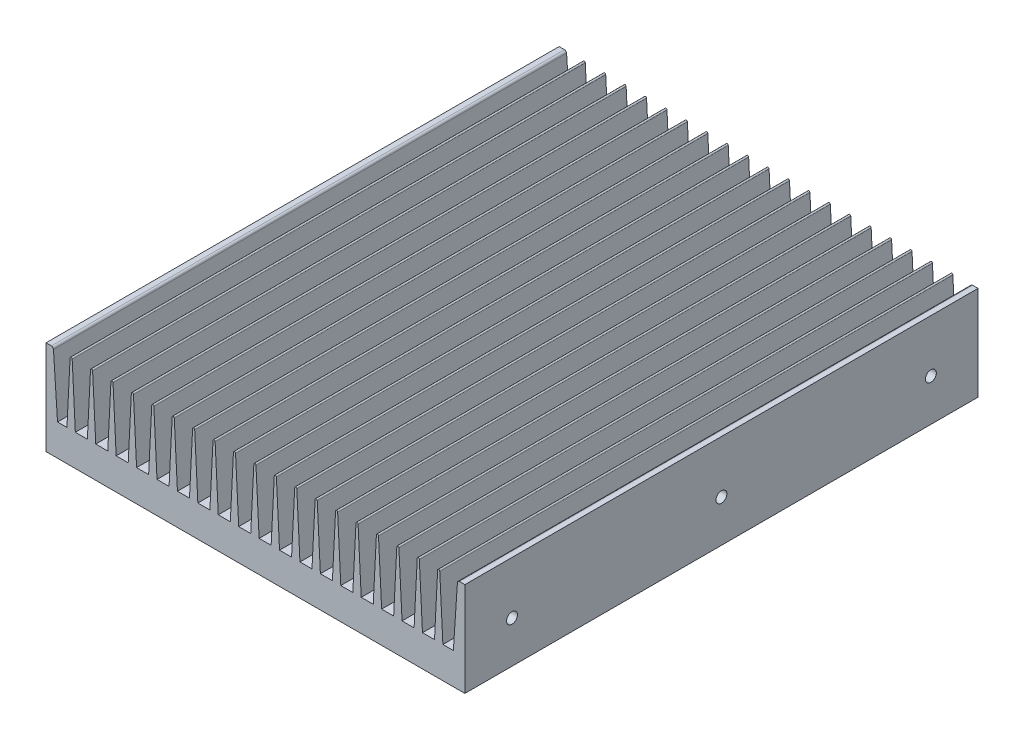
from build123d import *

# Parameters (mm, degrees)
EXTRUDE_1_DEPTH       = 245
EXTRUDE_3_DEPTH       = 245
PATTERN_CURVE_1_COUNT = 19
PATTERN_CURVE_1_PITCH = 9.75
SKETCH_7_R            = 2.6
CUT_EXTRUDE_4_DEPTH   = 6
SKETCH_8_R            = 4.5
SKETCH_8_R_2          = 3.4
CUT_EXTRUDE_5_DEPTH   = 6
CUT_EXTRUDE_START     = -6
SKETCH_9_R            = 2.6
CUT_EXTRUDE_6_DEPTH   = 6
EXTRUDE_4_REACH       = 321.453
SKETCH_11_R           = 2.6
EXTRUDE_5_REACH       = 321.453
SKETCH_12_R           = 4.5
SKETCH_12_R_2         = 3.4
SKETCH_19_R           = 2.6
CUT_EXTRUDE_12_DEPTH  = 8
SKETCH_21_R           = 2.6
SKETCH_21_R_2         = 1.6
SKETCH_21_R_3         = 1.3
SKETCH_21_R_4         = 2.1
CUT_EXTRUDE_13_DEPTH  = 10


with BuildPart() as part:
    # Эскиз1 → Вытянуть1 (new body)
    with BuildSketch(Plane.XY):
        with BuildLine():
            Line((0, 45), (2.564446908, 45))
            ThreePointArc((2.564446908, 45), (3.247630994, 44.730246195), (3.562232066, 44.066519011))
            Line((3.562232066, 44.066519011), (5.5, 15))
            Line((5.5, 15), (194.5, 15))
            Line((194.5, 15), (196.437767934, 44.066519011))
            ThreePointArc((196.437767934, 44.066519011), (196.752369006, 44.730246195), (197.435553092, 45))
            Line((197.435553092, 45), (200, 45))
            Line((200, 45), (200, 0))
            Line((200, 0), (0, 0))
            Line((0, 0), (0, 45))
        make_face()
    extrude(amount=EXTRUDE_1_DEPTH)

    # Эскиз2 → Вытянуть3 (add)
    with BuildSketch(Plane.XY.offset(245)):
        with BuildLine():
            Line((11.5, 44.5), (10, 15))
            Line((10, 15), (14, 15))
            Line((14, 15), (12.5, 44.5))
            ThreePointArc((12.5, 44.5), (12, 45), (11.5, 44.5))
        make_face()
    extrude_3 = extrude(amount=-EXTRUDE_3_DEPTH)

    # Кривая1: Вытянуть3 ×19
    with Locations(*[(i * PATTERN_CURVE_1_PITCH, 0, 0) for i in range(1, PATTERN_CURVE_1_COUNT)]):
        add(extrude_3)

    # Эскиз7 → Вырез-Вытянуть4 (cut)
    with BuildSketch(Plane.ZY):
        with Locations(Location((22.5, 20, 0), (0, 0, 270))):
            Circle(SKETCH_7_R)
        with Locations(Location((222.5, 20, 0), (0, 0, 270))):
            Circle(SKETCH_7_R)
        with Locations(Location((122.5, 20, 0), (0, 0, 270))):
            Circle(SKETCH_7_R)
    extrude(amount=-CUT_EXTRUDE_4_DEPTH, mode=Mode.SUBTRACT)

    # Эскиз8 → Вырез-Вытянуть5 (cut)
    with BuildSketch(Plane(origin=(200, 0, 0), x_dir=(0, 0, -1), z_dir=(1, 0, 0))):
        with Locations((-80, 30)):
            Circle(SKETCH_8_R)
        with Locations((-165, 30)):
            Circle(SKETCH_8_R_2)
    extrude(amount=-CUT_EXTRUDE_5_DEPTH, mode=Mode.SUBTRACT)

    # Эскиз9 → Вырез-Вытянуть6 (cut)
    with BuildSketch(Plane(origin=(200, 0, 0), x_dir=(0, 0, -1), z_dir=(1, 0, 0)).offset(CUT_EXTRUDE_START)):
        with Locations(Location((-22.5, 20, 0), (0, 0, 270))):
            Circle(SKETCH_9_R)
        with Locations(Location((-122.5, 20, 0), (0, 0, 270))):
            Circle(SKETCH_9_R)
        with Locations(Location((-222.5, 20, 0), (0, 0, 270))):
            Circle(SKETCH_9_R)
    extrude(amount=CUT_EXTRUDE_6_DEPTH, mode=Mode.SUBTRACT)

    # Вытянуть4: up to this face of the body (flat: up to its plane)
    extrude_4_end = Plane(part.part.faces().sort_by_distance((4.525378677, 29.61931985, 122.5))[0])
    # Эскиз11 → Вытянуть4 (add, up to the picked face)
    with BuildSketch(Plane.ZY, mode=Mode.PRIVATE) as extrude_4_sk1:
        with Locations(Location((22.5, 20, 0), (0, 0, 180))):
            Circle(SKETCH_11_R)
    extrude_4_tool1 = split(extrude(extrude_4_sk1.sketch, amount=-EXTRUDE_4_REACH, mode=Mode.PRIVATE), bisect_by=extrude_4_end, keep=Keep.BOTH, mode=Mode.PRIVATE)
    # Эскиз11 → Вытянуть4 (add, up to the picked face)
    with BuildSketch(Plane.ZY, mode=Mode.PRIVATE) as extrude_4_sk2:
        with Locations(Location((122.5, 20, 0), (0, 0, 180))):
            Circle(SKETCH_11_R)
    extrude_4_tool2 = split(extrude(extrude_4_sk2.sketch, amount=-EXTRUDE_4_REACH, mode=Mode.PRIVATE), bisect_by=extrude_4_end, keep=Keep.BOTH, mode=Mode.PRIVATE)
    # Эскиз11 → Вытянуть4 (add, up to the picked face)
    with BuildSketch(Plane.ZY, mode=Mode.PRIVATE) as extrude_4_sk3:
        with Locations(Location((222.5, 20, 0), (0, 0, 180))):
            Circle(SKETCH_11_R)
    extrude_4_tool3 = split(extrude(extrude_4_sk3.sketch, amount=-EXTRUDE_4_REACH, mode=Mode.PRIVATE), bisect_by=extrude_4_end, keep=Keep.BOTH, mode=Mode.PRIVATE)
    add(extrude_4_tool1.solids().sort_by(Axis((0, 20, 22.5), (1, 0, 0)))[0])
    add(extrude_4_tool2.solids().sort_by(Axis((0, 20, 122.5), (1, 0, 0)))[0])
    add(extrude_4_tool3.solids().sort_by(Axis((0, 20, 222.5), (1, 0, 0)))[0])

    # Вытянуть5: up to this face of the body (flat: up to its plane)
    extrude_5_end = Plane(part.part.faces().sort_by_distance((195.474256805, 29.613852069, 122.666761542))[0])
    # Эскиз12 → Вытянуть5 (add, up to the picked face)
    with BuildSketch(Plane(origin=(200, 0, 0), x_dir=(0, 0, -1), z_dir=(1, 0, 0)), mode=Mode.PRIVATE) as extrude_5_sk1:
        with Locations((-80, 30)):
            Circle(SKETCH_12_R)
    extrude_5_tool1 = split(extrude(extrude_5_sk1.sketch, amount=-EXTRUDE_5_REACH, mode=Mode.PRIVATE), bisect_by=extrude_5_end, keep=Keep.BOTH, mode=Mode.PRIVATE)
    # Эскиз12 → Вытянуть5 (add, up to the picked face)
    with BuildSketch(Plane(origin=(200, 0, 0), x_dir=(0, 0, -1), z_dir=(1, 0, 0)), mode=Mode.PRIVATE) as extrude_5_sk2:
        with Locations((-165, 30)):
            Circle(SKETCH_12_R_2)
    extrude_5_tool2 = split(extrude(extrude_5_sk2.sketch, amount=-EXTRUDE_5_REACH, mode=Mode.PRIVATE), bisect_by=extrude_5_end, keep=Keep.BOTH, mode=Mode.PRIVATE)
    add(extrude_5_tool1.solids().sort_by(Axis((200, 30, 80), (-1, 0, 0)))[0])
    add(extrude_5_tool2.solids().sort_by(Axis((200, 30, 165), (-1, 0, 0)))[0])

    # Эскиз19 → Вырез-Вытянуть12 (cut)
    with BuildSketch(Plane.ZY):
        with Locations(Location((222.5, 20, 0), (0, 0, 180))):
            Circle(SKETCH_19_R)
        with Locations(Location((122.5, 20, 0), (0, 0, 180))):
            Circle(SKETCH_19_R)
        with Locations(Location((22.5, 20, 0), (0, 0, 180))):
            Circle(SKETCH_19_R)
    extrude(amount=-CUT_EXTRUDE_12_DEPTH, mode=Mode.SUBTRACT)

    # Эскиз21 → Вырез-Вытянуть13 (cut)
    with BuildSketch(Plane.XZ):
        with Locations((36.5, 47)):
            Circle(SKETCH_21_R)
        with Locations((10, 145)):
            Circle(SKETCH_21_R_2)
        with Locations((10, 10)):
            Circle(SKETCH_21_R_2)
        with Locations((130, 10)):
            Circle(SKETCH_21_R_2)
        with Locations((130, 145)):
            Circle(SKETCH_21_R_2)
        with Locations((50.25, 141.4)):
            Circle(SKETCH_21_R_2)
        with Locations((90.25, 141.4)):
            Circle(SKETCH_21_R_2)
        with Locations((50.25, 57.6)):
            Circle(SKETCH_21_R_2)
        with Locations((90.25, 57.6)):
            Circle(SKETCH_21_R_2)
        with Locations((93, 18.5)):
            Circle(SKETCH_21_R_3)
        with Locations((134, 205)):
            Circle(SKETCH_21_R_4)
        with Locations((155, 145)):
            Circle(SKETCH_21_R_4)
        with Locations((189, 205)):
            Circle(SKETCH_21_R_4)
        with Locations((155, 10)):
            Circle(SKETCH_21_R_4)
        with Locations((76, 234)):
            Circle(SKETCH_21_R_2)
        with Locations((10, 234)):
            Circle(SKETCH_21_R_2)
        with Locations((10, 186)):
            Circle(SKETCH_21_R_2)
        with Locations((76, 186)):
            Circle(SKETCH_21_R_2)
    extrude(amount=-CUT_EXTRUDE_13_DEPTH, mode=Mode.SUBTRACT)


solid = part.part
